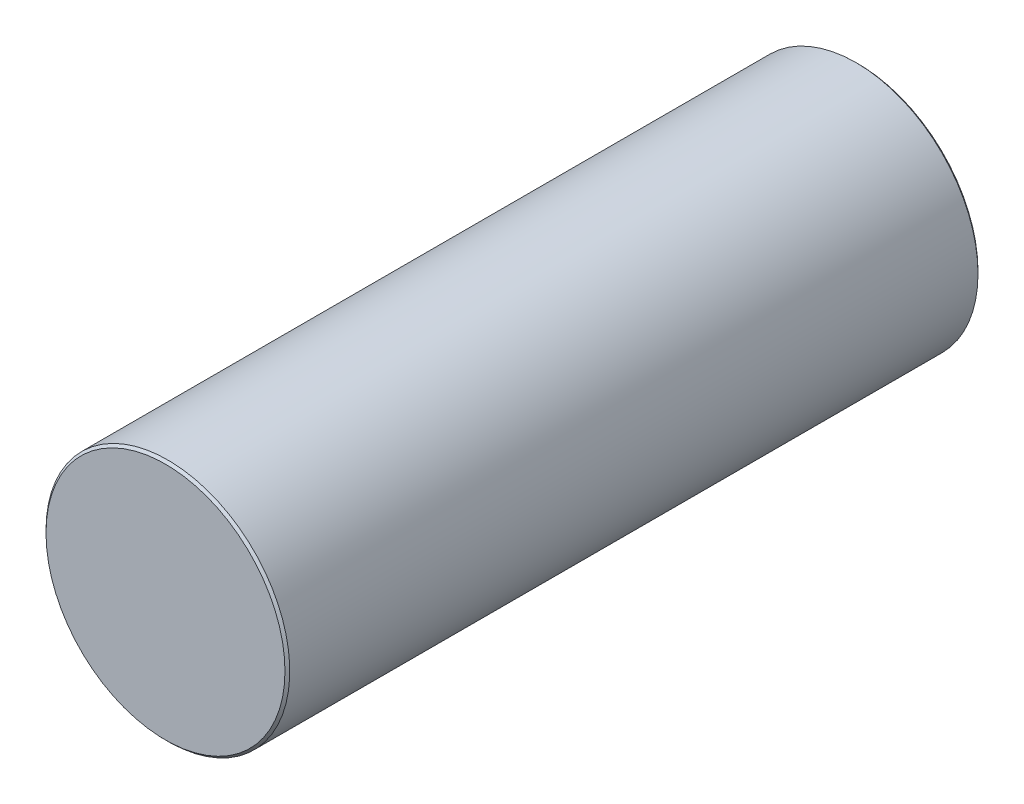
from build123d import *

# Parameters (mm, degrees)
SKETCH2_R           = 2.55
BOSS_EXTRUDE1_DEPTH = 14.5
CHAMFER2_SIZE       = 0.05


with BuildPart() as part:
    # Sketch2 → Boss-Extrude1 (new body)
    with BuildSketch(Plane.XY):
        with Locations(Location((0, 0, 0), (0, 0, 180))):
            Circle(SKETCH2_R)
    extrude(amount=BOSS_EXTRUDE1_DEPTH)

    # Chamfer2
    chamfer2_edges = [part.edges().sort_by_distance(p)[0] for p in [
        (2.55, 0, 0),
        (2.55, 0, 14.5),
    ]]
    chamfer(chamfer2_edges, length=CHAMFER2_SIZE)


solid = part.part
